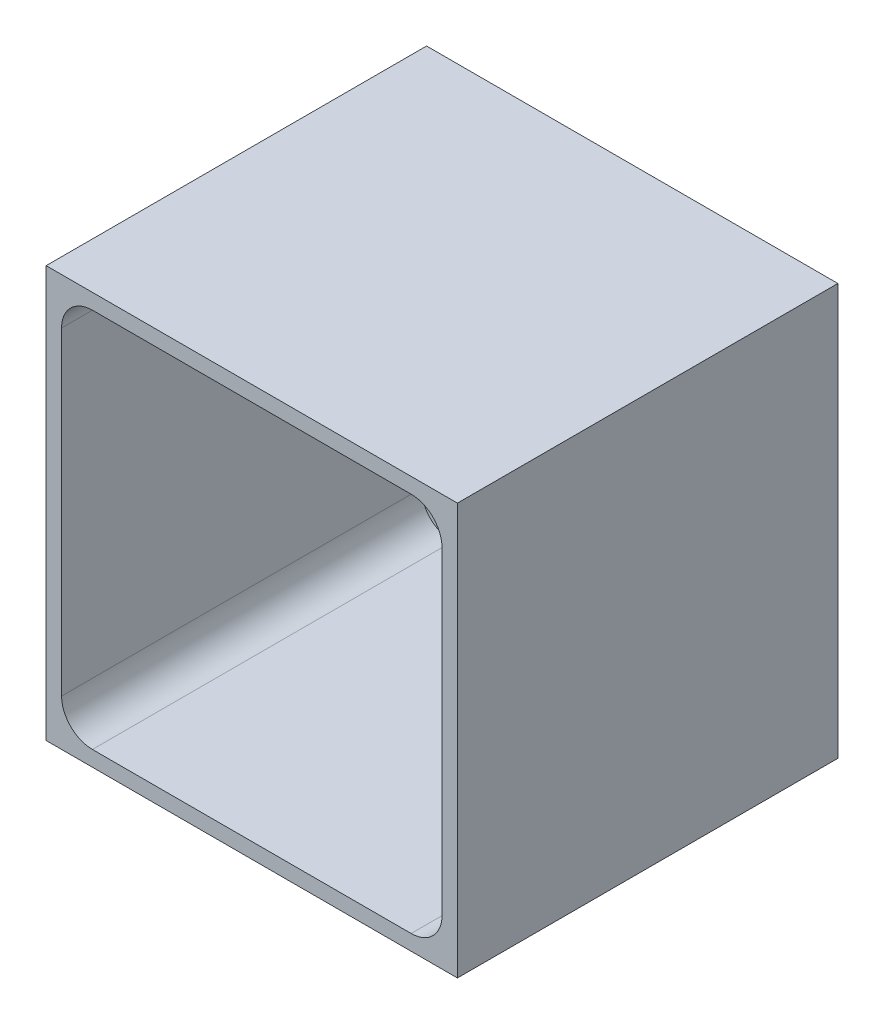
from build123d import *

# Parameters (mm, degrees)
SKETCH1_W           = 40
SKETCH1_H           = 40
SKETCH1_W_2         = 37
SKETCH1_H_2         = 37
BOSS_EXTRUDE1_DEPTH = 35
SKETCH2_W           = 40
SKETCH2_H           = 40
BOSS_EXTRUDE2_DEPTH = 2
FILLET1_R           = 3


with BuildPart() as part:
    # Sketch1 → Boss-Extrude1 (new body)
    with BuildSketch(Plane(origin=(0, 0, 0), x_dir=(0, 1, 0), z_dir=(0, 0, 1))):
        Rectangle(SKETCH1_W, SKETCH1_H)
        Rectangle(SKETCH1_W_2, SKETCH1_H_2, mode=Mode.SUBTRACT)
    extrude(amount=BOSS_EXTRUDE1_DEPTH)

    # Sketch2 → Boss-Extrude2 (add)
    with BuildSketch(Plane(origin=(0, 0, 0), x_dir=(1, 0, 0), z_dir=(0, 0, -1))):
        Rectangle(SKETCH2_W, SKETCH2_H)
    extrude(amount=BOSS_EXTRUDE2_DEPTH)

    # Fillet1
    fillet1_edges = [part.edges().sort_by_distance(p)[0] for p in [
        (18.5, 18.5, 17.5),
        (-18.5, 18.5, 17.5),
        (-18.5, -18.5, 17.5),
        (18.5, -18.5, 17.5),
    ]]
    fillet(fillet1_edges, radius=FILLET1_R)


solid = part.part
